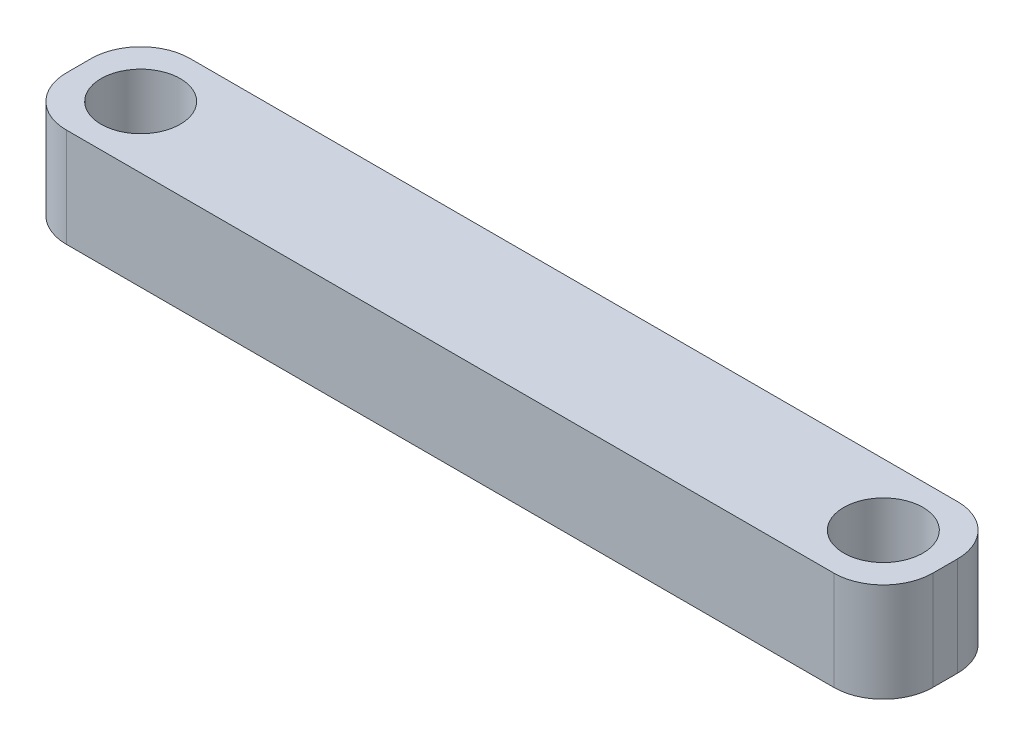
from build123d import *

# Parameters (mm, degrees)
SKETCH_1_W      = 35
SKETCH_1_H      = 5
SKETCH_1_R      = 1.6
EXTRUDE_1_DEPTH = 4
FILLET_1_R      = 2


with BuildPart() as part:
    # 草图1 → 凸台-拉伸1 (new body)
    with BuildSketch(Plane(origin=(0, 0, 0), x_dir=(1, 0, 0), z_dir=(0, 1, 0))):
        Rectangle(SKETCH_1_W, SKETCH_1_H)
        with Locations(Location((-15, 0, 0), (0, 0, 270))):
            Circle(SKETCH_1_R, mode=Mode.SUBTRACT)
        with Locations(Location((15, 0, 0), (0, 0, 90))):
            Circle(SKETCH_1_R, mode=Mode.SUBTRACT)
    extrude(amount=EXTRUDE_1_DEPTH)

    # 圆角1
    fillet_1_edges = [part.edges().sort_by_distance(p)[0] for p in [
        (17.5, 2, 2.5),
        (-17.5, 2, 2.5),
        (-17.5, 2, -2.5),
        (17.5, 2, -2.5),
    ]]
    fillet(fillet_1_edges, radius=FILLET_1_R)


solid = part.part
